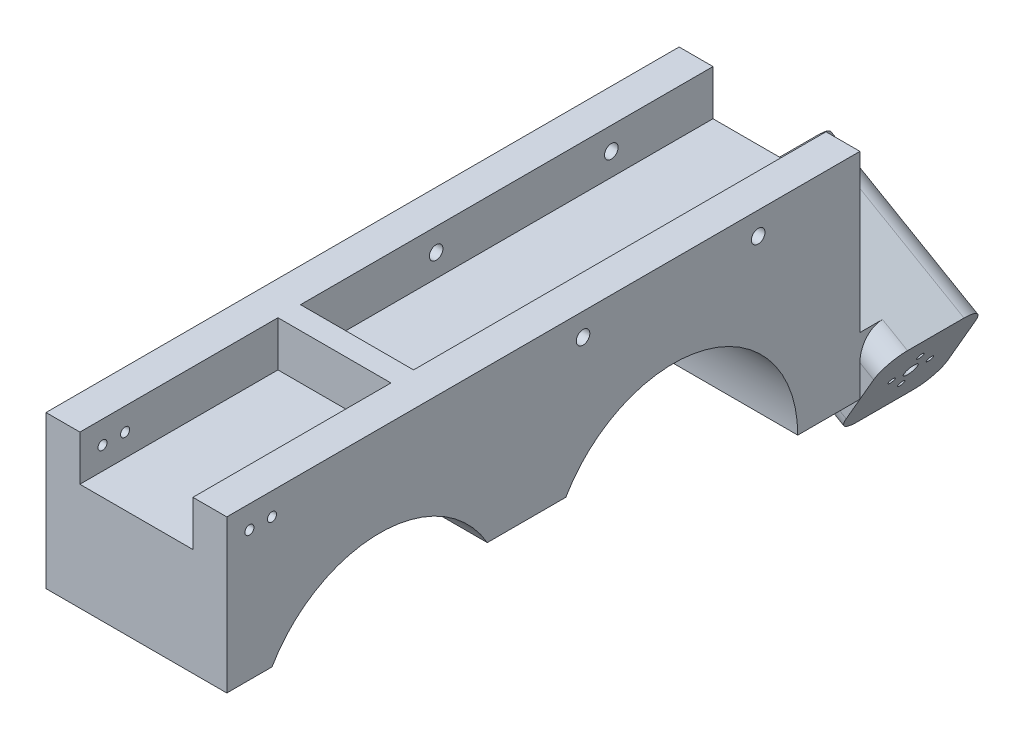
from build123d import *
from build123d.topology import SkipClean

# Parameters (mm, degrees)
SKETCH_1_R               = 3
SKETCH_1_R_2             = 2
EXTRUDE_1_DEPTH          = 80
CUT_EXTRUDE_4_REACH      = 297.59
CUT_EXTRUDE_4_END_RADIUS = 55
SKETCH_4_W               = 15
SKETCH_4_H               = 20
SKETCH_5_W               = 75
SKETCH_5_H               = 45
EXTRUDE_2_DEPTH          = 22.15
SKETCH_10_R              = 12.5
CUT_EXTRUDE_5_DEPTH      = 60
SKETCH_12_R              = 3
SKETCH_12_R_2            = 1.5
CUT_EXTRUDE_6_DEPTH      = 15
FILLET_1_R               = 10
SKETCH_13_W              = 50
SKETCH_13_H              = 20
CUT_EXTRUDE_7_DEPTH      = 280.131397208
CUT_EXTRUDE_8_REACH      = 303.476
CUT_EXTRUDE_8_END_RADIUS = 55
SKETCH_14_W              = 15
SKETCH_14_H              = 20
SKETCH_15_W              = 50
SKETCH_15_H              = 10
EXTRUDE_3_DEPTH          = 20


with BuildPart() as part:
    # Эскиз1 → Бобышка-Вытянуть1 (new body)
    with BuildSketch(Plane(origin=(0, 0, 0), x_dir=(0, 0, -1), z_dir=(1, 0, 0))):
        with BuildLine():
            Line((0, 0), (0, -95))
            Line((0, -95), (-27.5, -95))
            ThreePointArc((-27.5, -95), (-40.221163687, -59.821881801), (-72.5, -40.916730868))
            Line((-72.5, -40.916730868), (-72.5, -50))
            Line((-72.5, -50), (-92.5, -50))
            Line((-92.5, -50), (-92.5, -40.916730868))
            ThreePointArc((-92.5, -40.916730868), (-114.23345294, -50.077979069), (-130.131397208, -67.5))
            Line((-130.131397208, -67.5), (-164.868602792, -67.5))
            ThreePointArc((-164.868602792, -67.5), (-180.76654706, -50.077979069), (-202.5, -40.916730868))
            Line((-202.5, -40.916730868), (-202.5, -50))
            Line((-202.5, -50), (-222.5, -50))
            Line((-222.5, -50), (-222.5, -40.916730868))
            ThreePointArc((-222.5, -40.916730868), (-244.23345294, -50.077979069), (-260.131397208, -67.5))
            Line((-260.131397208, -67.5), (-280.131397208, -67.5))
            Line((-280.131397208, -67.5), (-280.131397208, 0))
            Line((-280.131397208, 0), (0, 0))
        make_face()
        with Locations((-45, -10)):
            Circle(SKETCH_1_R, mode=Mode.SUBTRACT)
        with Locations((-122.5, -10)):
            Circle(SKETCH_1_R, mode=Mode.SUBTRACT)
        with Locations((-270.131397208, -10)):
            Circle(SKETCH_1_R_2, mode=Mode.SUBTRACT)
        with Locations((-260.131397208, -10)):
            Circle(SKETCH_1_R_2, mode=Mode.SUBTRACT)
    extrude(amount=EXTRUDE_1_DEPTH)

    # Вырез-Вытянуть4: up to this cylinder (the profile starts inside it)
    with SkipClean():  # the faces are left unmerged after this step: merging them gives an invalid solid
        cut_extrude_4_end = Plane(origin=(40, -95, 82.5), z_dir=(-1, 0, 0)) * Cylinder(CUT_EXTRUDE_4_END_RADIUS, 771.18, mode=Mode.PRIVATE)
        # Эскиз4 → Вырез-Вытянуть4 (cut, up to the surface)
        with BuildSketch(Plane.XZ.offset(50), mode=Mode.PRIVATE) as cut_extrude_4_sk1:
            with Locations((7.5, 82.5)):
                Rectangle(SKETCH_4_W, SKETCH_4_H)
        cut_extrude_4_tool1 = extrude(cut_extrude_4_sk1.sketch, amount=-CUT_EXTRUDE_4_REACH, mode=Mode.PRIVATE) & cut_extrude_4_end
        add(cut_extrude_4_tool1.solids().sort_by_distance((7.5, -50, 82.5))[0], mode=Mode.SUBTRACT)
        # Эскиз4 → Вырез-Вытянуть4 (cut, up to the surface)
        with BuildSketch(Plane.XZ.offset(50), mode=Mode.PRIVATE) as cut_extrude_4_sk2:
            with Locations((72.5, 82.5)):
                Rectangle(SKETCH_4_W, SKETCH_4_H)
        cut_extrude_4_tool2 = extrude(cut_extrude_4_sk2.sketch, amount=-CUT_EXTRUDE_4_REACH, mode=Mode.PRIVATE) & cut_extrude_4_end
        add(cut_extrude_4_tool2.solids().sort_by_distance((72.5, -50, 82.5))[0], mode=Mode.SUBTRACT)

    # Эскиз5 → Бобышка-Вытянуть2 (add, symmetric)
    with SkipClean():  # the faces are left unmerged after this step: merging them gives an invalid solid
        with BuildSketch(Plane(origin=(-21.13620668, -36.608983849, 0), x_dir=(-0.8660254037844379, 0.5000000000000012, 0), z_dir=(0.5000000000000012, 0.8660254037844379, 0))):
            with Locations((-79.282032303, -22.5)):
                Rectangle(SKETCH_5_W, SKETCH_5_H)
        extrude(amount=EXTRUDE_2_DEPTH, both=True)

    # Эскиз10 → Вырез-Вытянуть5 (cut)
    with SkipClean():  # the faces are left unmerged after this step: merging them gives an invalid solid
        with BuildSketch(Plane(origin=(36.184301396, -20.891016151, 0), x_dir=(0, 0, 1), z_dir=(-0.866025403784438, 0.5000000000000012, 0))):
            with Locations(Location((-22.5, -42.27241336, 0), (0, 0, 270))):
                Circle(SKETCH_10_R)
        extrude(amount=-CUT_EXTRUDE_5_DEPTH, mode=Mode.SUBTRACT)

    # Эскиз12 → Вырез-Вытянуть6 (cut)
    with SkipClean():  # the faces are left unmerged after this step: merging them gives an invalid solid
        with BuildSketch(Plane(origin=(88.145825623, -50.891016151, 0), x_dir=(0, 0, 1), z_dir=(-0.866025403784438, 0.5000000000000012, 0))):
            with Locations(Location((-22.5, -42.27241336, 0), (0, 0, 270))):
                Circle(SKETCH_12_R)
            with Locations(Location((-22.5, -33.77241336, 0), (0, 0, 270))):
                Circle(SKETCH_12_R_2)
            with Locations(Location((-14, -42.27241336, 0), (0, 0, 270))):
                Circle(SKETCH_12_R_2)
            with Locations(Location((-22.5, -50.77241336, 0), (0, 0, 270))):
                Circle(SKETCH_12_R_2)
            with Locations(Location((-31, -42.27241336, 0), (0, 0, 270))):
                Circle(SKETCH_12_R_2)
        extrude(amount=-CUT_EXTRUDE_6_DEPTH, mode=Mode.SUBTRACT)

    # Скругление1
    fillet_1_edges = [part.edges().sort_by_distance(p)[0] for p in [
        (52.3125, -104.591231347, 0),
        (36.449047358, -95.432462694, -45),
        (58.599047358, -57.067537306, -45),
        (85.5375, -72.620460191, 0),
    ]]
    fillet(fillet_1_edges, radius=FILLET_1_R)

    # Эскиз13 → Вырез-Вытянуть7 (cut)
    with BuildSketch(Plane(origin=(0, 0, 0), x_dir=(-1, 0, 0), z_dir=(0, 0, -1))):
        with Locations((-40, -10)):
            Rectangle(SKETCH_13_W, SKETCH_13_H)
    extrude(amount=-CUT_EXTRUDE_7_DEPTH, mode=Mode.SUBTRACT)

    # Вырез-Вытянуть8: up to this cylinder (the profile starts inside it)
    with SkipClean():  # the faces are left unmerged after this step: merging them gives an invalid solid
        cut_extrude_8_end = Plane(origin=(40, -95, 212.5), z_dir=(-1, 0, 0)) * Cylinder(CUT_EXTRUDE_8_END_RADIUS, 782.952, mode=Mode.PRIVATE)
        # Эскиз14 → Вырез-Вытянуть8 (cut, up to the surface)
        with BuildSketch(Plane.XZ.offset(50), mode=Mode.PRIVATE) as cut_extrude_8_sk1:
            with Locations((7.5, 212.5)):
                Rectangle(SKETCH_14_W, SKETCH_14_H)
        cut_extrude_8_tool1 = extrude(cut_extrude_8_sk1.sketch, amount=-CUT_EXTRUDE_8_REACH, mode=Mode.PRIVATE) & cut_extrude_8_end
        add(cut_extrude_8_tool1.solids().sort_by_distance((7.5, -50, 212.5))[0], mode=Mode.SUBTRACT)
        # Эскиз14 → Вырез-Вытянуть8 (cut, up to the surface)
        with BuildSketch(Plane.XZ.offset(50), mode=Mode.PRIVATE) as cut_extrude_8_sk2:
            with Locations((72.5, 212.5)):
                Rectangle(SKETCH_14_W, SKETCH_14_H)
        cut_extrude_8_tool2 = extrude(cut_extrude_8_sk2.sketch, amount=-CUT_EXTRUDE_8_REACH, mode=Mode.PRIVATE) & cut_extrude_8_end
        add(cut_extrude_8_tool2.solids().sort_by_distance((72.5, -50, 212.5))[0], mode=Mode.SUBTRACT)

    # Эскиз15 → Бобышка-Вытянуть3 (add)
    with SkipClean():  # the faces are left unmerged after this step: merging them gives an invalid solid
        with BuildSketch(Plane(origin=(0, -20, 0), x_dir=(1, 0, 0), z_dir=(0, 1, 0))):
            with Locations((40, -187.5)):
                Rectangle(SKETCH_15_W, SKETCH_15_H)
        extrude(amount=EXTRUDE_3_DEPTH)


solid = part.part
